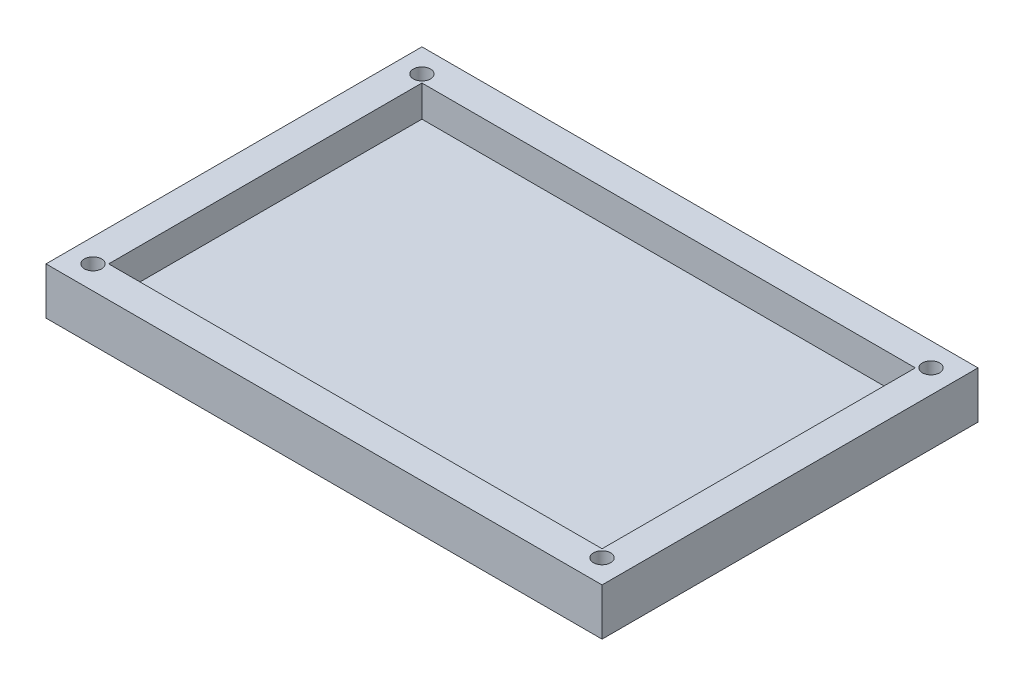
from build123d import *

# Parameters (mm, degrees)
SKETCH_1_W          = 35.5
SKETCH_1_H          = 24
EXTRUDE_1_DEPTH     = 3
SKETCH_2_W          = 31.5
SKETCH_2_H          = 20
CUT_EXTRUDE_1_DEPTH = 2
SKETCH_3_R          = 0.55
CUT_EXTRUDE_2_DEPTH = 2


with BuildPart() as part:
    # 草图1 → 凸台-拉伸1 (new body)
    with BuildSketch(Plane(origin=(0, 0, 0), x_dir=(1, 0, 0), z_dir=(0, 1, 0))):
        Rectangle(SKETCH_1_W, SKETCH_1_H)
    extrude(amount=EXTRUDE_1_DEPTH)

    # 草图2 → 切除-拉伸1 (cut)
    with BuildSketch(Plane(origin=(0, 3, 0), x_dir=(1, 0, 0), z_dir=(0, 1, 0))):
        Rectangle(SKETCH_2_W, SKETCH_2_H)
    extrude(amount=-CUT_EXTRUDE_1_DEPTH, mode=Mode.SUBTRACT)

    # 草图3 → 切除-拉伸2 (cut)
    with BuildSketch(Plane(origin=(0, 3, 0), x_dir=(1, 0, 0), z_dir=(0, 1, 0))):
        with Locations(Location((-16.25, 10.5, 0), (0, 0, 270))):
            Circle(SKETCH_3_R)
        with Locations(Location((-16.25, -10.5, 0), (0, 0, 270))):
            Circle(SKETCH_3_R)
        with Locations(Location((16.25, -10.5, 0), (0, 0, 270))):
            Circle(SKETCH_3_R)
        with Locations(Location((16.25, 10.5, 0), (0, 0, 270))):
            Circle(SKETCH_3_R)
    extrude(amount=-CUT_EXTRUDE_2_DEPTH, mode=Mode.SUBTRACT)


solid = part.part
